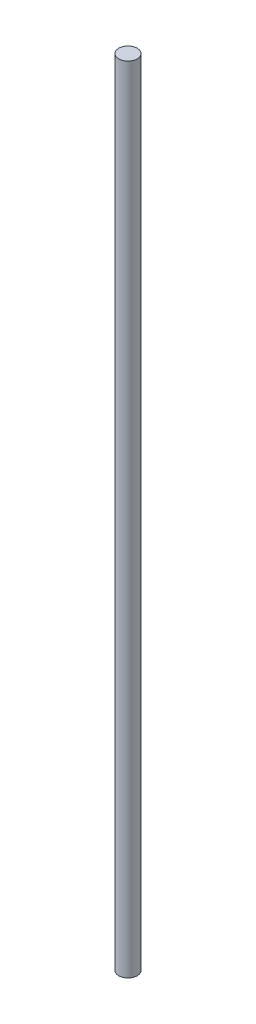
from build123d import *

# Parameters (mm, degrees)
SKETCH1_R           = 3.9878
BOSS_EXTRUDE1_DEPTH = 342.9


with BuildPart() as part:
    # Sketch1 → Boss-Extrude1 (new body)
    with BuildSketch(Plane(origin=(0, 0, 0), x_dir=(1, 0, 0), z_dir=(0, 1, 0))):
        with Locations(Location((0, 0, 0), (0, 0, 270))):
            Circle(SKETCH1_R)
    extrude(amount=BOSS_EXTRUDE1_DEPTH)


solid = part.part
